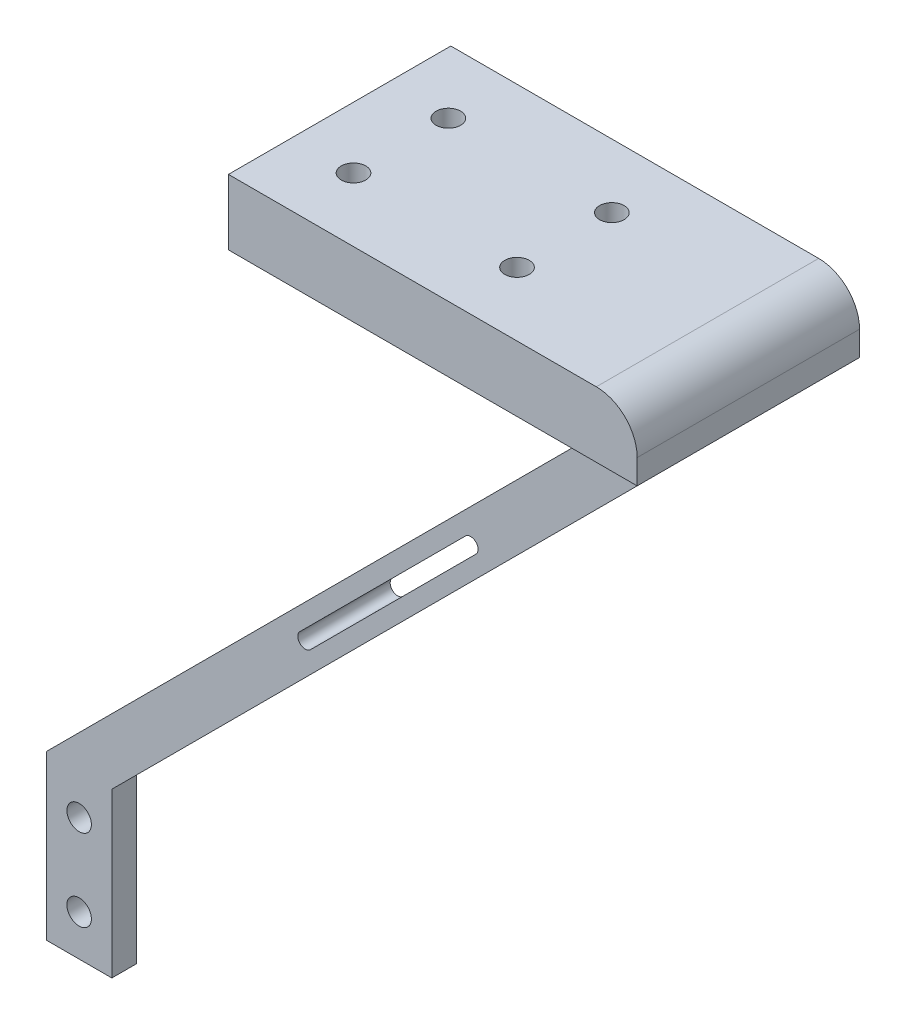
from build123d import *

# Parameters (mm, degrees)
CROQUIS1_W                          = 8
CROQUIS1_H                          = 20
CROQUIS1_R                          = 1.5
SALIENTE_EXTRUIR1_DEPTH             = 3
SALIENTE_EXTRUIR2_DEPTH             = 8.3
CROQUIS2_W                          = 16
CROQUIS2_H                          = 3.5
SALIENTE_EXTRUIR3_DEPTH             = 11.6
SALIENTE_EXTRUIR5_REACH             = 150.418
SALIENTE_EXTRUIR5_DIRECTION_2_REACH = 150.418
SALIENTE_EXTRUIR6_START             = -8
CROQUIS3_W                          = 50
CROQUIS3_H                          = 2
SALIENTE_EXTRUIR6_DEPTH             = 8
CORTAR_EXTRUIR1_REACH               = 116.976
CROQUIS3_3_R                        = 1.5
REDONDEO1_R                         = 5
CORTAR_EXTRUIR2_DEPTH               = 995.229505316


with BuildPart() as part:
    # Croquis1 → Saliente-Extruir1 (new body)
    # profile 1 of 2: a face of its own
    with BuildSketch(Plane.XY):
        with Locations((-18.490607503, -982.48)):
            Rectangle(CROQUIS1_W, CROQUIS1_H)
        with Locations((-18.490607503, -987.48)):
            Circle(CROQUIS1_R, mode=Mode.SUBTRACT)
        with Locations((-18.490607503, -977.48)):
            Circle(CROQUIS1_R, mode=Mode.SUBTRACT)
    # profile 2 of 2: a face of its own
    with BuildSketch(Plane.XY):
        Polygon((42.220070616, -907.769321881), (-22.490607503, -972.48), (-14.490607503, -972.48), (56.220070616, -901.769321881), (48.220070616, -901.769321881), align=None)
    extrude(amount=SALIENTE_EXTRUIR1_DEPTH)

    # Croquis1<5> → Saliente-Extruir2 (add)
    with BuildSketch(Plane.XY):
        Polygon((42.220070616, -907.769321881), (-22.490607503, -972.48), (-14.490607503, -972.48), (56.220070616, -901.769321881), (48.220070616, -901.769321881), align=None)
    extrude(amount=-SALIENTE_EXTRUIR2_DEPTH)

    # Croquis2 → Saliente-Extruir3 (add, symmetric)
    with BuildSketch(Plane(origin=(-26.288644344, -1016.59343949, -4.15), x_dir=(1, 0, 0), z_dir=(0, 0, 1))):
        Polygon((68.50871496, 114.824117609), (74.50871496, 114.824117609), (82.50871496, 114.824117609), (82.50871496, 117.074117609), (66.50871496, 117.074117609), (32.50871496, 117.074117609), (32.50871496, 114.824117609), align=None)
        with Locations((74.50871496, 118.824117609)):
            Rectangle(CROQUIS2_W, CROQUIS2_H)
        Polygon((66.50871496, 120.574117609), (82.50871496, 120.574117609), (82.50871496, 122.824117609), (32.50871496, 122.824117609), (32.50871496, 120.574117609), align=None)
    extrude(amount=SALIENTE_EXTRUIR3_DEPTH, both=True)

    # Saliente-Extruir5: up to this face of the body (flat: up to its plane)
    saliente_extruir5_end = Plane(part.part.faces().sort_by_distance((9.617113618, -946.422214796, 3))[0])
    # Croquis2<4> → Saliente-Extruir5 (add, up to the picked face)
    with BuildSketch(Plane(origin=(-26.288644344, -1016.59343949, -4.15), x_dir=(1, 0, 0), z_dir=(0, 0, 1)), mode=Mode.PRIVATE) as saliente_extruir5_sk1:
        Polygon((68.50871496, 114.824117609), (68.50871496, 108.824117609), (74.50871496, 114.824117609), align=None)
    saliente_extruir5_tool1 = split(extrude(saliente_extruir5_sk1.sketch, amount=SALIENTE_EXTRUIR5_REACH, mode=Mode.PRIVATE), bisect_by=saliente_extruir5_end, keep=Keep.BOTH, mode=Mode.PRIVATE)
    add(saliente_extruir5_tool1.solids().sort_by(Axis((44.220071, -903.769322, -4.15), (0, 0, 1)))[0])

    # Saliente-Extruir5 direction 2: up to this face of the body (flat: up to its plane)
    saliente_extruir5_direction_2_end = Plane(part.part.faces().sort_by_distance((16.864731556, -937.124660941, -8.3))[0])
    # Croquis2<4> → Saliente-Extruir5 direction 2 (add, up to the picked face)
    with BuildSketch(Plane(origin=(-26.288644344, -1016.59343949, -4.15), x_dir=(1, 0, 0), z_dir=(0, 0, 1)), mode=Mode.PRIVATE) as saliente_extruir5_direction_2_sk1:
        Polygon((68.50871496, 114.824117609), (68.50871496, 108.824117609), (74.50871496, 114.824117609), align=None)
    saliente_extruir5_direction_2_tool1 = split(extrude(saliente_extruir5_direction_2_sk1.sketch, amount=-SALIENTE_EXTRUIR5_DIRECTION_2_REACH, mode=Mode.PRIVATE), bisect_by=saliente_extruir5_direction_2_end, keep=Keep.BOTH, mode=Mode.PRIVATE)
    add(saliente_extruir5_direction_2_tool1.solids().sort_by(Axis((44.220071, -903.769322, -4.15), (0, 0, -1)))[0])

    # Croquis3 → Saliente-Extruir6 (add)
    with BuildSketch(Plane(origin=(0, -893.769321881, 0), x_dir=(1, 0, 0), z_dir=(0, 1, 0)).offset(SALIENTE_EXTRUIR6_START)):
        with Locations((31.220070616, 16.75)):
            Rectangle(CROQUIS3_W, CROQUIS3_H)
        with Locations((31.220070616, -8.45)):
            Rectangle(CROQUIS3_W, CROQUIS3_H)
    extrude(amount=SALIENTE_EXTRUIR6_DEPTH)

    # Cortar-Extruir1: up to this face of the body (flat: up to its plane)
    cortar_extruir1_end = Plane(part.part.faces().sort_by_distance((28.850624784, -901.769321881, -4.347453819))[0])
    # Croquis3<3> → Cortar-Extruir1 (cut, up to the picked face)
    with BuildSketch(Plane(origin=(0, -893.769321881, 0), x_dir=(1, 0, 0), z_dir=(0, 1, 0)), mode=Mode.PRIVATE) as cortar_extruir1_sk1:
        with Locations(Location((13.720070616, -1.65, 0), (0, 0, 270))):
            Circle(CROQUIS3_3_R)
    cortar_extruir1_tool1 = split(extrude(cortar_extruir1_sk1.sketch, amount=-CORTAR_EXTRUIR1_REACH, mode=Mode.PRIVATE), bisect_by=cortar_extruir1_end, keep=Keep.BOTH, mode=Mode.PRIVATE)
    # Croquis3<3> → Cortar-Extruir1 (cut, up to the picked face)
    with BuildSketch(Plane(origin=(0, -893.769321881, 0), x_dir=(1, 0, 0), z_dir=(0, 1, 0)), mode=Mode.PRIVATE) as cortar_extruir1_sk2:
        with Locations(Location((33.720070616, 9.95, 0), (0, 0, 270))):
            Circle(CROQUIS3_3_R)
    cortar_extruir1_tool2 = split(extrude(cortar_extruir1_sk2.sketch, amount=-CORTAR_EXTRUIR1_REACH, mode=Mode.PRIVATE), bisect_by=cortar_extruir1_end, keep=Keep.BOTH, mode=Mode.PRIVATE)
    # Croquis3<3> → Cortar-Extruir1 (cut, up to the picked face)
    with BuildSketch(Plane(origin=(0, -893.769321881, 0), x_dir=(1, 0, 0), z_dir=(0, 1, 0)), mode=Mode.PRIVATE) as cortar_extruir1_sk3:
        with Locations(Location((33.720070616, -1.65, 0), (0, 0, 270))):
            Circle(CROQUIS3_3_R)
    cortar_extruir1_tool3 = split(extrude(cortar_extruir1_sk3.sketch, amount=-CORTAR_EXTRUIR1_REACH, mode=Mode.PRIVATE), bisect_by=cortar_extruir1_end, keep=Keep.BOTH, mode=Mode.PRIVATE)
    # Croquis3<3> → Cortar-Extruir1 (cut, up to the picked face)
    with BuildSketch(Plane(origin=(0, -893.769321881, 0), x_dir=(1, 0, 0), z_dir=(0, 1, 0)), mode=Mode.PRIVATE) as cortar_extruir1_sk4:
        with Locations(Location((13.720070616, 9.95, 0), (0, 0, 270))):
            Circle(CROQUIS3_3_R)
    cortar_extruir1_tool4 = split(extrude(cortar_extruir1_sk4.sketch, amount=-CORTAR_EXTRUIR1_REACH, mode=Mode.PRIVATE), bisect_by=cortar_extruir1_end, keep=Keep.BOTH, mode=Mode.PRIVATE)
    add(cortar_extruir1_tool1.solids().sort_by(Axis((13.720071, -893.769322, 1.65), (0, -1, 0)))[0], mode=Mode.SUBTRACT)
    add(cortar_extruir1_tool2.solids().sort_by(Axis((33.720071, -893.769322, -9.95), (0, -1, 0)))[0], mode=Mode.SUBTRACT)
    add(cortar_extruir1_tool3.solids().sort_by(Axis((33.720071, -893.769322, 1.65), (0, -1, 0)))[0], mode=Mode.SUBTRACT)
    add(cortar_extruir1_tool4.solids().sort_by(Axis((13.720071, -893.769322, -9.95), (0, -1, 0)))[0], mode=Mode.SUBTRACT)

    # Redondeo1
    redondeo1_edges = [part.edges().sort_by_distance(p)[0] for p in [
        (56.220070616, -893.769321881, -4.15),
    ]]
    fillet(redondeo1_edges, radius=REDONDEO1_R)

    # Croquis4 → Cortar-Extruir2 (cut, through all)
    with BuildSketch(Plane(origin=(0, 0, -8.3), x_dir=(-1, 0, 0), z_dir=(0, 0, -1))):
        with BuildLine():
            Line((-30.042390628, -924.033116126), (-8.522287998, -945.553218756))
            ThreePointArc((-8.522287998, -945.553218756), (-8.256992809, -944.912739511), (-8.522287998, -944.272260266))
            Line((-8.522287998, -944.272260266), (-28.761432138, -924.033116126))
            ThreePointArc((-28.761432138, -924.033116126), (-29.401911383, -923.767820936), (-30.042390628, -924.033116126))
        make_face()
        with BuildLine():
            ThreePointArc((-9.803246488, -945.553218756), (-9.162767243, -945.818513946), (-8.522287998, -945.553218756))
            Line((-8.522287998, -945.553218756), (-30.042390628, -924.033116126))
            ThreePointArc((-30.042390628, -924.033116126), (-30.307685818, -924.673595371), (-30.042390628, -925.314074616))
            Line((-30.042390628, -925.314074616), (-9.803246488, -945.553218756))
        make_face()
    extrude(amount=-CORTAR_EXTRUIR2_DEPTH, mode=Mode.SUBTRACT)


solid = part.part
